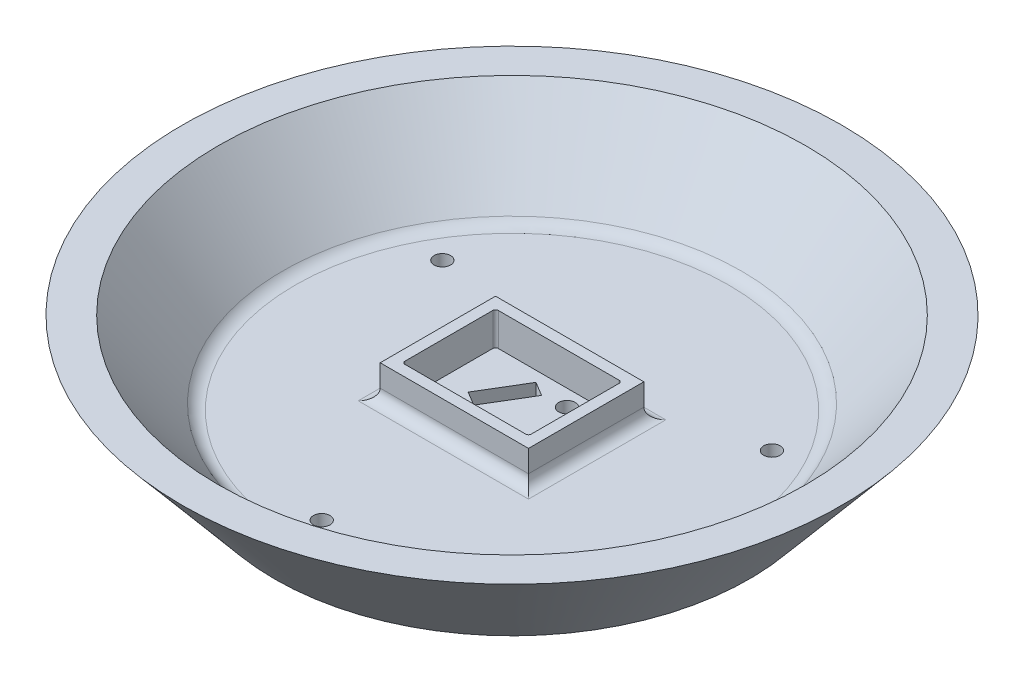
from build123d import *

# Parameters (mm, degrees)
SKETCH1_R                 = 60
BOSS_EXTRUDE1_DEPTH       = 20
BOSS_EXTRUDE1_DRAFT       = -40
SHELL1_T                  = -5
SKETCH3_W                 = 27
SKETCH3_H                 = 21
BOSS_EXTRUDE2_DEPTH       = 6
F_3_0MM_DOWEL_HOLE1_D     = 3
F_3_0MM_DOWEL_HOLE1_DEPTH = 4
F_3_0MM_DOWEL_HOLE1_TIP   = 0.901290929
F_3_0MM_DOWEL_HOLE2_D     = 3
F_3_0MM_DOWEL_HOLE2_DEPTH = 10
F_3_0MM_DOWEL_HOLE2_TIP   = 0.901290929
FILLET2_R                 = 2
F_3_0MM_DOWEL_HOLE3_D     = 3
F_3_0MM_DOWEL_HOLE3_DEPTH = 4
F_3_0MM_DOWEL_HOLE3_TIP   = 0.901290929
CUT_EXTRUDE1_DEPTH        = 10
FILLET3_R                 = 3


with BuildPart() as part:
    # Sketch1 → Boss-Extrude1 (with draft: the straight prism first)
    with BuildSketch(Plane(origin=(0, 0, 0), x_dir=(1, 0, 0), z_dir=(0, 1, 0))):
        Circle(SKETCH1_R)
    extrude(amount=-BOSS_EXTRUDE1_DEPTH)
    # Boss-Extrude1: the draft: its side faces are tilted about the plane it starts from
    boss_extrude1_sides = [part.faces().sort_by_distance(p)[0] for p in [
        (-60, -10, 0),
    ]]
    draft(boss_extrude1_sides, Plane(origin=(0, 0, 0), x_dir=(1, 0, 0), z_dir=(0, 1, 0)), BOSS_EXTRUDE1_DRAFT)

    # Shell1
    shell1_openings = [part.faces().sort_by_distance(p)[0] for p in [
        (0, 0, 0),
    ]]
    offset(amount=SHELL1_T, openings=shell1_openings, kind=Kind.INTERSECTION)

    # Sketch3 → Boss-Extrude2 (add)
    with BuildSketch(Plane(origin=(0, -15, 0), x_dir=(1, 0, 0), z_dir=(0, 1, 0))):
        Rectangle(SKETCH3_W, SKETCH3_H)
        with BuildLine():
            Line((-11, 8.5), (11, 8.5))
            ThreePointArc((11, 8.5), (11.353553391, 8.353553391), (11.5, 8))
            Line((11.5, 8), (11.5, -8))
            ThreePointArc((11.5, -8), (11.353553391, -8.353553391), (11, -8.5))
            Line((11, -8.5), (-11, -8.5))
            ThreePointArc((-11, -8.5), (-11.353553391, -8.353553391), (-11.5, -8))
            Line((-11.5, -8), (-11.5, 8))
            ThreePointArc((-11.5, 8), (-11.353553391, 8.353553391), (-11, 8.5))
        make_face(mode=Mode.SUBTRACT)
    extrude(amount=BOSS_EXTRUDE2_DEPTH)

    # Ø3.0mm Dowel Hole1
    with Locations(Plane(origin=(0, -15, 0), x_dir=(1, 0, 0), z_dir=(0, 1, 0))):
        with Locations((-29.999119987, 17.32), (29.999119987, 17.32), (0, -34.64)):
            Hole(F_3_0MM_DOWEL_HOLE1_D / 2, depth=F_3_0MM_DOWEL_HOLE1_DEPTH)
            with Locations((0, 0, -(F_3_0MM_DOWEL_HOLE1_DEPTH + F_3_0MM_DOWEL_HOLE1_TIP / 2))):  # 118° drill point
                Cone(0, F_3_0MM_DOWEL_HOLE1_D / 2, F_3_0MM_DOWEL_HOLE1_TIP, mode=Mode.SUBTRACT)

    # Ø3.0mm Dowel Hole2
    with Locations(Plane(origin=(0, -15, 0), x_dir=(1, 0, 0), z_dir=(0, 1, 0))):
        with Locations((4.5, 5.5), (4.5, -6.5)):
            Hole(F_3_0MM_DOWEL_HOLE2_D / 2, depth=F_3_0MM_DOWEL_HOLE2_DEPTH)
            with Locations((0, 0, -(F_3_0MM_DOWEL_HOLE2_DEPTH + F_3_0MM_DOWEL_HOLE2_TIP / 2))):  # 118° drill point
                Cone(0, F_3_0MM_DOWEL_HOLE2_D / 2, F_3_0MM_DOWEL_HOLE2_TIP, mode=Mode.SUBTRACT)

    # Fillet2
    fillet2_edges = [part.edges().sort_by_distance(p)[0] for p in [
        (-13.5, -15, 0),
        (0, -15, 10.5),
        (13.5, -15, 0),
        (0, -15, -10.5),
    ]]
    fillet(fillet2_edges, radius=FILLET2_R)

    # Ø3.0mm Dowel Hole3
    with Locations(Plane(origin=(0, -20, 0), x_dir=(-1, 0, 0), z_dir=(0, -1, 0))):
        with Locations((0, -19), (-16.454482672, 9.5), (16.454482672, 9.5)):
            Hole(F_3_0MM_DOWEL_HOLE3_D / 2, depth=F_3_0MM_DOWEL_HOLE3_DEPTH)
            with Locations((0, 0, -(F_3_0MM_DOWEL_HOLE3_DEPTH + F_3_0MM_DOWEL_HOLE3_TIP / 2))):  # 118° drill point
                Cone(0, F_3_0MM_DOWEL_HOLE3_D / 2, F_3_0MM_DOWEL_HOLE3_TIP, mode=Mode.SUBTRACT)

    # Sketch11 → Cut-Extrude1 (cut)
    with BuildSketch(Plane.XZ.offset(20)):
        Polygon((0.341916748, -5.046701194), (-2.228267182, -6.594006776), (-6.87018393, 1.116545014), (-4.3, 2.663850596), align=None)
    extrude(amount=-CUT_EXTRUDE1_DEPTH, mode=Mode.SUBTRACT)

    # Fillet3
    fillet3_edges = [part.edges().sort_by_distance(p)[0] for p in [
        (-40.886469086, -15, 0),
    ]]
    fillet(fillet3_edges, radius=FILLET3_R)


solid = part.part
